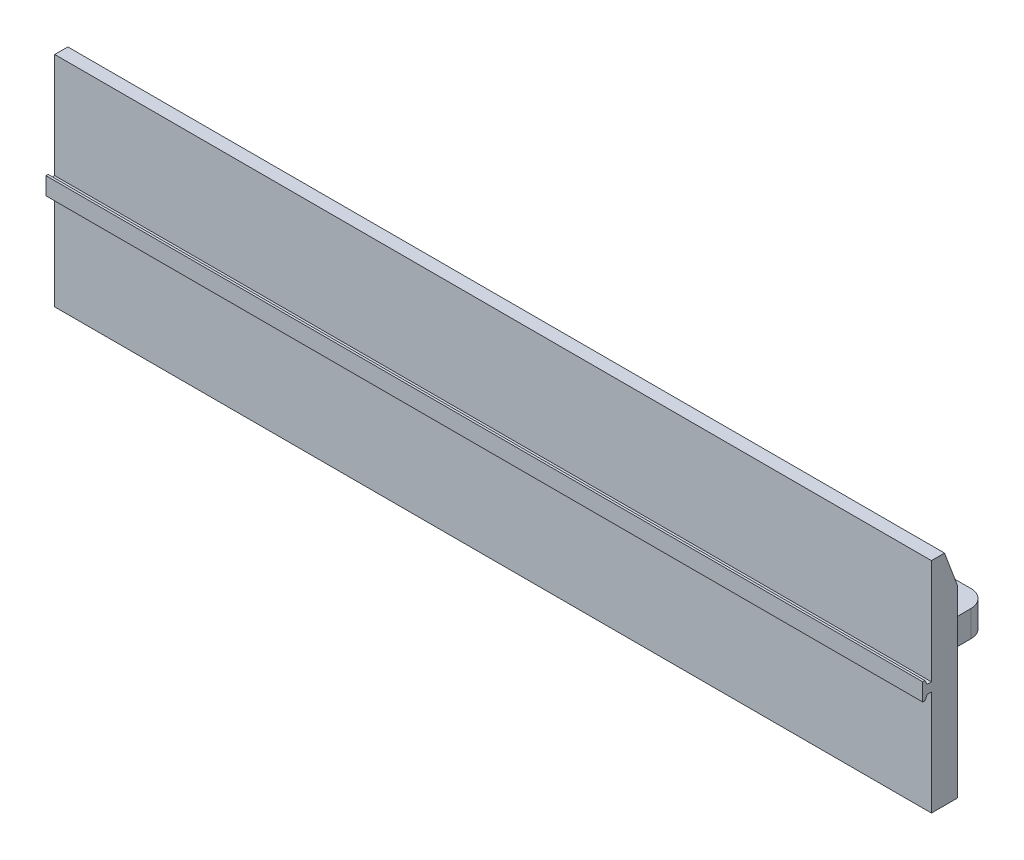
from build123d import *

# Parameters (mm, degrees)
EXTRUDE_1_DEPTH          = 1002.5
CUT_EXTRUDE_1_DEPTH      = 1058.062557278
CUT_EXTRUDE_1_DEPTH_BACK = 1058.062557278
SKETCH_2_W               = 400
SKETCH_2_H               = 185
CUT_EXTRUDE_2_DEPTH      = 1058.062557278
CUT_EXTRUDE_2_DEPTH_BACK = 1058.062557278
SKETCH_3_W               = 150
SKETCH_3_H               = 185
RIB_1_REACH              = 842.69
SKETCH_4_WALL_W          = 1799.999144386
SKETCH_4_WALL_H          = 20
RIB_2_REACH              = 842.69
SKETCH_5_WALL_W          = 1799.999144386
SKETCH_5_WALL_H          = 20
FILLET_2_R               = 20


with BuildPart() as part:
    # 草图1 → 凸台-拉伸1 (new body)
    with BuildSketch(Plane(origin=(1027.5, 0, 0), x_dir=(0, 0, -1), z_dir=(1, 0, 0))):
        Polygon((-105, 300), (-105, 180), (-110, 180), (-112.5, 185), (-115, 185), (-115, 165), (-112.5, 165), (-110, 170), (-105, 170), (-105, 50), (-75, 50), (110, 50), (110, 80), (-75, 80), (-75, 260), (-90, 300), align=None)
    extrude(amount=-EXTRUDE_1_DEPTH)

    # 草图2 → 切除-拉伸1 (cut, two sides: drawn at the far end of the back side and taken through both)
    with BuildSketch(Plane(origin=(0, 80, 0), x_dir=(1, 0, 0), z_dir=(0, 1, 0)).offset(-CUT_EXTRUDE_1_DEPTH_BACK)):
        with Locations((526.25, 17.5)):
            Rectangle(SKETCH_2_W, SKETCH_2_H)
    extrude(amount=CUT_EXTRUDE_1_DEPTH + CUT_EXTRUDE_1_DEPTH_BACK, mode=Mode.SUBTRACT)

    # 草图3 → 切除-拉伸2 (cut, two sides: drawn at the far end of the back side and taken through both)
    with BuildSketch(Plane(origin=(0, 80, 0), x_dir=(1, 0, 0), z_dir=(0, 1, 0)).offset(-CUT_EXTRUDE_2_DEPTH_BACK)):
        with Locations((100, 17.5)):
            Rectangle(SKETCH_3_W, SKETCH_3_H)
        with Locations((952.5, 17.5)):
            Rectangle(SKETCH_3_W, SKETCH_3_H)
    extrude(amount=CUT_EXTRUDE_2_DEPTH + CUT_EXTRUDE_2_DEPTH_BACK, mode=Mode.SUBTRACT)

    # 草图4 wall → 筋1 (add, up to next)
    with BuildSketch(Plane(origin=(801.875, 130, 45), x_dir=(0, 0.857492925713, 0.514495755428), z_dir=(0, -0.514495755428, 0.857492925713)), mode=Mode.PRIVATE) as rib_1_sk1:
        Rectangle(SKETCH_4_WALL_W, SKETCH_4_WALL_H)
    rib_1_tool1 = extrude(rib_1_sk1.sketch, amount=RIB_1_REACH, mode=Mode.PRIVATE) - part.part
    add(rib_1_tool1.solids().sort_by_distance((801.875, 130, 45))[0])

    # 草图5 wall → 筋2 (add, up to next)
    with BuildSketch(Plane(origin=(250.625, 130, 45), x_dir=(0, -0.857492925713, -0.514495755428), z_dir=(0, 0.514495755428, -0.857492925713)), mode=Mode.PRIVATE) as rib_2_sk1:
        Rectangle(SKETCH_5_WALL_W, SKETCH_5_WALL_H)
    rib_2_tool1 = extrude(rib_2_sk1.sketch, amount=-RIB_2_REACH, mode=Mode.PRIVATE) - part.part
    add(rib_2_tool1.solids().sort_by_distance((250.625, 130, 45))[0])

    # 圆角2
    fillet_2_edges = [part.edges().sort_by_distance(p)[0] for p in [
        (326.25, 65, -110),
        (726.25, 65, -110),
        (175, 65, -110),
        (877.5, 65, -110),
    ]]
    fillet(fillet_2_edges, radius=FILLET_2_R)


solid = part.part
